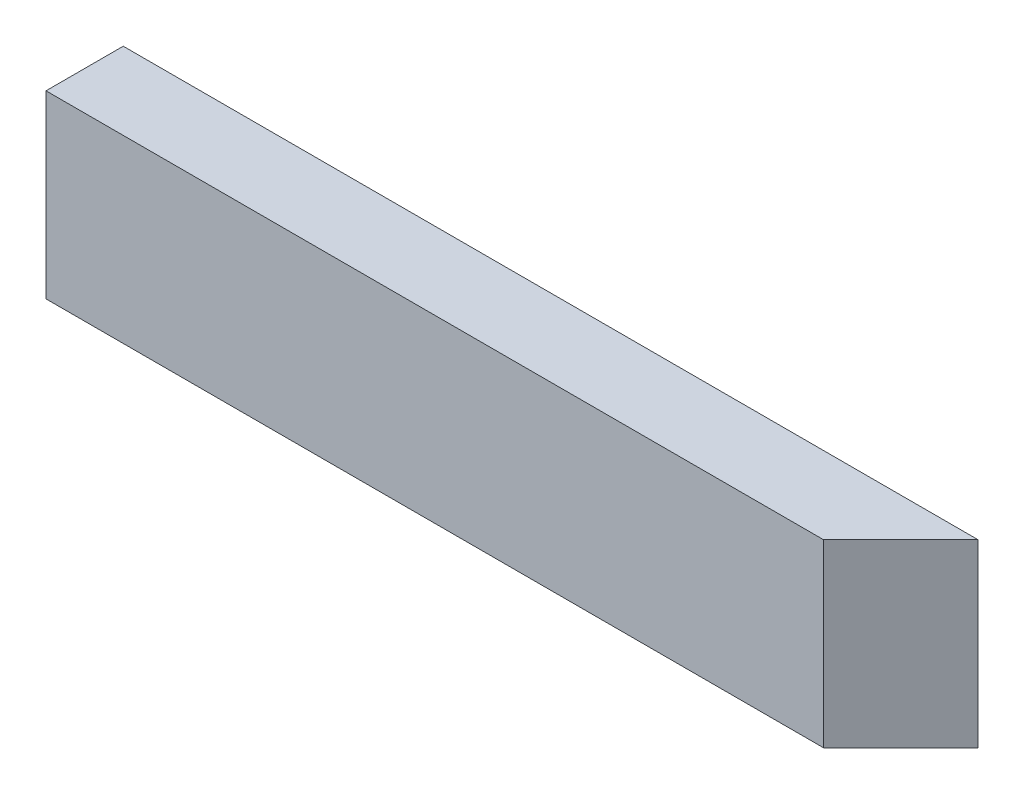
from build123d import *

# Parameters (mm, degrees)
BOSS_EXTRUDE2_DEPTH = 88.9


with BuildPart() as part:
    # Sketch1 → Boss-Extrude2 (new body)
    with BuildSketch(Plane(origin=(0, 0, 0), x_dir=(1, 0, 0), z_dir=(0, 1, 0))):
        Polygon((421.64, 38.1), (383.54, 0), (0, 0), (0, 38.1), align=None)
    extrude(amount=BOSS_EXTRUDE2_DEPTH)


solid = part.part
